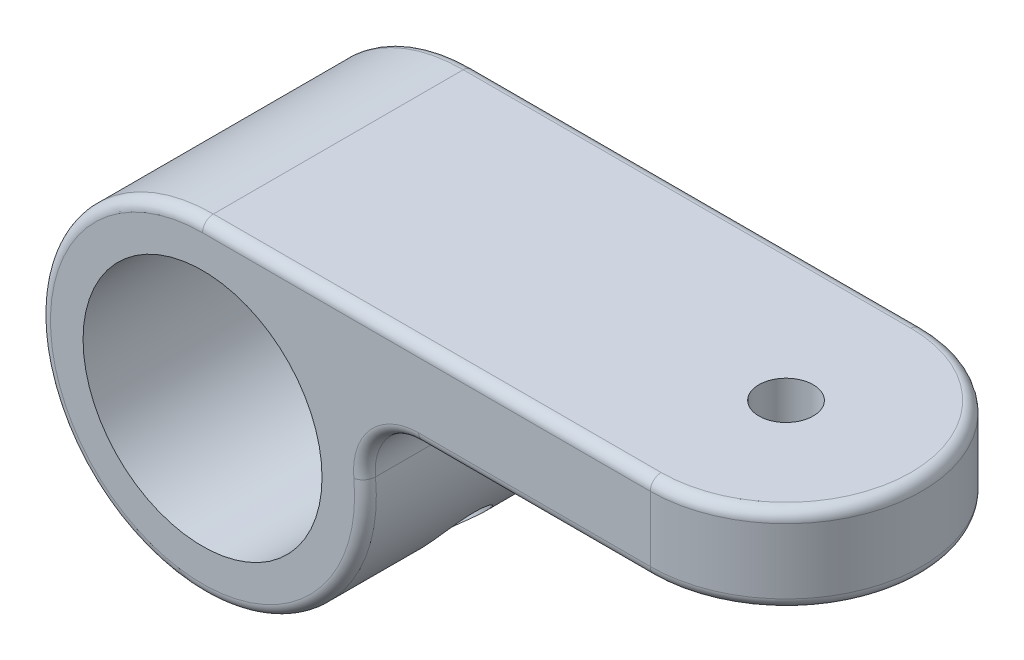
from build123d import *

# Parameters (mm, degrees)
ESBO_O1_R                  = 15
RESSALTO_EXTRUS_O1_DEPTH   = 12.5
RESSALTO_EXTRUS_O2_DEPTH   = 8
FILETE1_R                  = 5
ESBO_O3_R                  = 11
CORTE_EXTRUS_O1_DEPTH      = 62.120606846
CORTE_EXTRUS_O2_REACH      = 53.678
CORTE_EXTRUS_O2_END_RADIUS = 11
ESBO_O6_R                  = 3
FURO_ROSCADO_DE_M62_D      = 5
FILETE2_R                  = 1


with BuildPart() as part:
    # Esboço1 → Ressalto-extrusão1 (new, symmetric)
    with BuildSketch(Plane.XY):
        Circle(ESBO_O1_R)
    extrude(amount=RESSALTO_EXTRUS_O1_DEPTH, both=True)

    # Esboço2 → Ressalto-extrusão2 (add)
    with BuildSketch(Plane(origin=(0, 15, 0), x_dir=(1, 0, 0), z_dir=(0, 1, 0))):
        with BuildLine():
            Line((41.21897785, 12.5), (0, 12.5))
            Line((0, 12.5), (0, -12.5))
            Line((0, -12.5), (41.21897785, -12.5))
            ThreePointArc((41.21897785, -12.5), (53.71897785, 0), (41.21897785, 12.5))
        make_face()
    extrude(amount=-RESSALTO_EXTRUS_O2_DEPTH)

    # Filete1
    filete1_edges = [part.edges().sort_by_distance(p)[0] for p in [
        (13.266499161, 7, 0),
    ]]
    fillet(filete1_edges, radius=FILETE1_R)

    # Esboço3 → Corte-extrusão1 (cut, through all)
    with BuildSketch(Plane(origin=(0, 0, -12.5), x_dir=(-1, 0, 0), z_dir=(0, 0, -1))):
        Circle(ESBO_O3_R)
    extrude(amount=-CORTE_EXTRUS_O1_DEPTH, mode=Mode.SUBTRACT)

    # Corte-extrusão2: up to this cylinder (the profile starts outside it)
    corte_extrus_o2_end = Plane(origin=(0, 0, 0), z_dir=(0, 0, -1)) * Cylinder(CORTE_EXTRUS_O2_END_RADIUS, 130.356, mode=Mode.PRIVATE)
    # Esboço6 → Corte-extrusão2 (cut, up to the surface)
    with BuildSketch(Plane(origin=(10.606601718, -10.606601718, 0), x_dir=(0, 0, -1), z_dir=(0.7071067811865464, -0.7071067811865488, 0)), mode=Mode.PRIVATE) as corte_extrus_o2_sk1:
        with Locations(Location((0, 0, 0), (0, 0, 90))):
            Circle(ESBO_O6_R)
    corte_extrus_o2_tool1 = extrude(corte_extrus_o2_sk1.sketch, amount=-CORTE_EXTRUS_O2_REACH, mode=Mode.PRIVATE) - corte_extrus_o2_end
    add(corte_extrus_o2_tool1.solids().sort_by_distance((10.606602, -10.606602, 0))[0], mode=Mode.SUBTRACT)

    # Furo roscado de M62 (through all)
    with Locations(Plane(origin=(0, 15, 0), x_dir=(1, 0, 0), z_dir=(0, 1, 0))):
        with Locations((41.21897785, 0)):
            Hole(FURO_ROSCADO_DE_M62_D / 2)

    # Filete2
    filete2_edges = [part.edges().sort_by_distance(p)[0] for p in [
        (30.559363296, 7, -12.5),
        (53.71897785, 15, 0),
        (20.609488925, 15, -12.5),
        (20.609488925, 15, 12.5),
        (30.559363296, 7, 12.5),
        (16.191649499, 5.354101966, -12.5),
        (16.191649499, 5.354101966, 12.5),
        (-10.062305899, -11.124297731, -12.5),
        (-10.062305899, -11.124297731, 12.5),
        (53.71897785, 7, 0),
    ]]
    fillet(filete2_edges, radius=FILETE2_R)


solid = part.part
